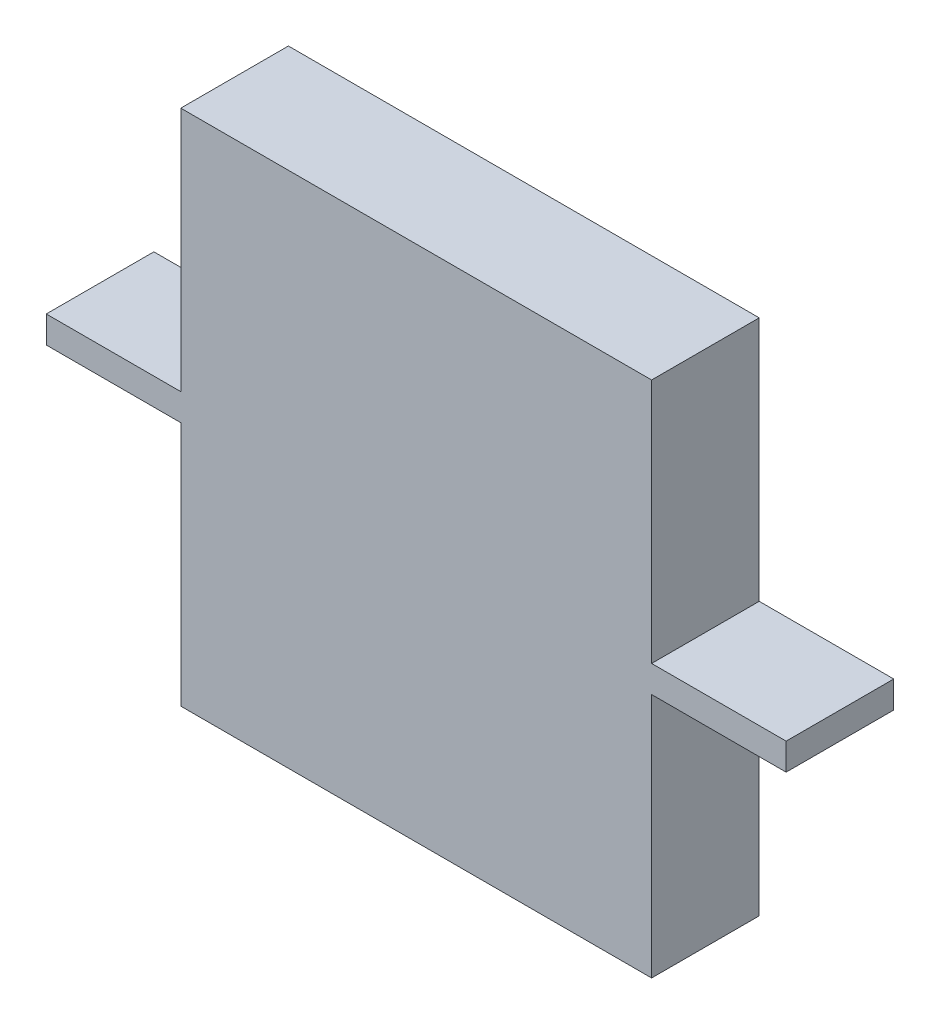
from build123d import *

# Parameters (mm, degrees)
SKETCH1_W           = 10
SKETCH1_H           = 2
SKETCH1_W_2         = 35
SKETCH1_H_2         = 38.5
BOSS_EXTRUDE1_DEPTH = 8


with BuildPart() as part:
    # Sketch1 → Boss-Extrude1 (new body)
    with BuildSketch(Plane.XY):
        with Locations((-5, 19.25)):
            Rectangle(SKETCH1_W, SKETCH1_H)
        with Locations((17.5, 19.25)):
            Rectangle(SKETCH1_W_2, SKETCH1_H_2)
        with Locations((40, 19.25)):
            Rectangle(SKETCH1_W, SKETCH1_H)
    extrude(amount=BOSS_EXTRUDE1_DEPTH)


solid = part.part
